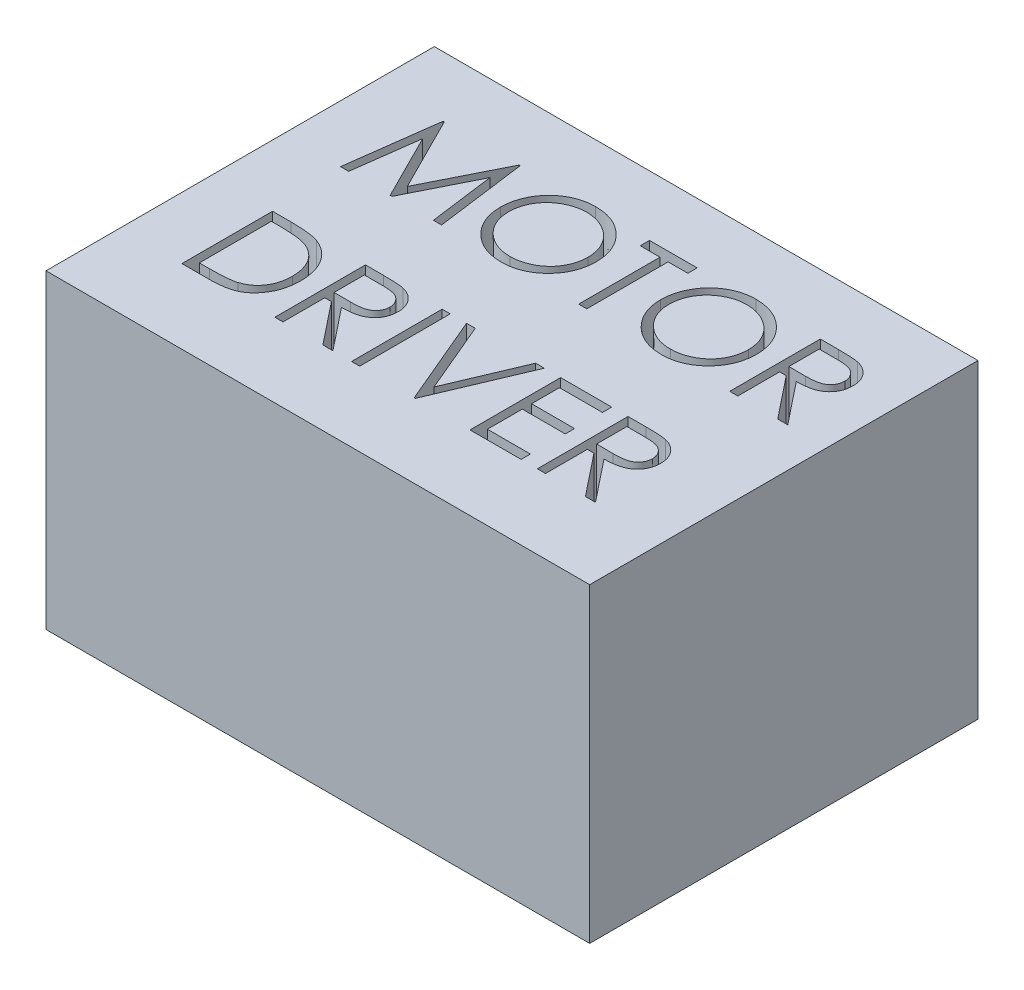
from build123d import *

# Parameters (mm, degrees)
SKETCH1_W           = 44.45
SKETCH1_H           = 31.75
BOSS_EXTRUDE1_DEPTH = 25.4
SKETCH2_W           = 0.664850428
SKETCH2_H           = 7.408333334
CUT_EXTRUDE1_DEPTH  = 12.7


with BuildPart() as part:
    # Sketch1 → Boss-Extrude1 (new body)
    with BuildSketch(Plane(origin=(0, 0, 0), x_dir=(1, 0, 0), z_dir=(0, 1, 0))):
        Rectangle(SKETCH1_W, SKETCH1_H)
    extrude(amount=BOSS_EXTRUDE1_DEPTH)

    # Sketch2 → Cut-Extrude1 (cut, symmetric)
    # profile 1 of 11: a face of its own
    with BuildSketch(Plane(origin=(0, 25.4, 0), x_dir=(1, 0, 0), z_dir=(0, 1, 0))):
        Polygon((-17.560377568, 3.540456421), (-16.582394462, 10.948789754), (-16.48741583, 10.948789754), (-13.428807055, 4.870157275), (-10.377618487, 10.948789754), (-10.281155813, 10.948789754), (-9.297236543, 3.540456421), (-9.965055052, 3.540456421), (-10.674426714, 8.871132169), (-13.348668834, 3.540456421), (-13.498556989, 3.540456421), (-16.183187397, 8.883004498), (-16.891075018, 3.540456421), align=None)
    # profile 2 of 11: a face of its own
    with BuildSketch(Plane(origin=(0, 25.4, 0), x_dir=(1, 0, 0), z_dir=(0, 1, 0))):
        with BuildLine():
            add(Edge.make_bspline(
                [(-4.310858338, 11.138747019), (-4.17368118, 11.135272554), (-3.904253925, 11.128448419), (-3.508278725, 11.076210983), (-3.13025244, 10.985839074), (-2.767095646, 10.865479095), (-2.423152179, 10.704920646), (-2.09583319, 10.510853748), (-1.785917474, 10.281245244), (-1.497582216, 10.017870047), (-1.233725005, 9.731308403), (-1.001260212, 9.425496827), (-0.806437357, 9.102284362), (-0.646447441, 8.76264227), (-0.52093205, 8.407338672), (-0.434320074, 8.034479366), (-0.378994323, 7.646480205), (-0.372526261, 7.381840008), (-0.36924509, 7.24759117)],
                knots=[0, 0, 0, 0, 1.065120563, 2.091984664, 3.0946048, 4.079830382, 5.057816894, 6.036188127, 7.030412546, 8.04752943, 9.064399622, 10.05169764, 11.02544977, 11.989514704, 12.962713494, 13.945757189, 14.957906945, 16, 16, 16, 16], degree=3))
            add(Edge.make_bspline(
                [(-0.36924509, 7.24759117), (-0.37252578, 7.114331242), (-0.378992401, 6.851660485), (-0.43438298, 6.466123528), (-0.521253097, 6.095514887), (-0.64528186, 5.740453256), (-0.804509123, 5.400564079), (-1.000629235, 5.076741693), (-1.231644798, 4.768879938), (-1.494549299, 4.480351464), (-1.781148172, 4.215773484), (-2.088552236, 3.98522853), (-2.409848097, 3.7868458), (-2.749170313, 3.62855369), (-3.102018724, 3.502036458), (-3.471551308, 3.415776725), (-3.856036514, 3.360135817), (-4.118230138, 3.353746625), (-4.251496692, 3.350499156)],
                knots=[0, 0, 0, 0, 1.043624062, 2.057103931, 3.04512605, 4.022047818, 4.998200453, 5.980619268, 6.982898556, 8.009068085, 9.034988726, 10.034168286, 11.015286542, 11.987931943, 12.962482838, 13.94673481, 14.956375938, 16, 16, 16, 16], degree=3))
            add(Edge.make_bspline(
                [(-4.251496692, 3.350499156), (-4.385744834, 3.353778691), (-4.650383658, 3.360243529), (-5.038870383, 3.415660836), (-5.411991607, 3.502319929), (-5.768680317, 3.626164902), (-6.109135418, 3.786221374), (-6.43402276, 3.981387309), (-6.742038288, 4.212965758), (-7.030628318, 4.475785008), (-7.294680788, 4.761898126), (-7.524888133, 5.068463966), (-7.720097956, 5.389468016), (-7.87961701, 5.725801109), (-8.005906782, 6.075837329), (-8.092065314, 6.441911606), (-8.147809746, 6.821936894), (-8.154233504, 7.080684362), (-8.157492953, 7.211974182)],
                knots=[0, 0, 0, 0, 1.053102029, 2.075944431, 3.073151272, 4.055350789, 5.033113405, 6.020478099, 7.024410459, 8.052272461, 9.079885166, 10.07527673, 11.055994387, 12.023226415, 12.992069828, 13.970394897, 14.97016774, 16, 16, 16, 16], degree=3))
            add(Edge.make_bspline(
                [(-8.157492953, 7.211974182), (-8.156361308, 7.300096665), (-8.154112294, 7.475229927), (-8.127036545, 7.735297564), (-8.08774761, 7.991182789), (-8.031440229, 8.242157963), (-7.957797867, 8.487608714), (-7.870904409, 8.729227828), (-7.76477507, 8.96456671), (-7.644801031, 9.194740223), (-7.510896871, 9.41616029), (-7.362993201, 9.625455408), (-7.206285005, 9.824381851), (-7.034489155, 10.007784676), (-6.853267679, 10.180999248), (-6.659680779, 10.341363666), (-6.454909695, 10.490323979), (-6.238073324, 10.624563701), (-6.014514643, 10.745973869), (-5.784058796, 10.85016012), (-5.54983572, 10.939580951), (-5.310748382, 11.012057364), (-5.067431681, 11.069275173), (-4.81935457, 11.108237405), (-4.566714685, 11.135382212), (-4.396510726, 11.137620591), (-4.310858338, 11.138747019)],
                knots=[0, 0, 0, 0, 1.037015668, 2.060948919, 3.074880161, 4.083647147, 5.086022904, 6.090072063, 7.104153813, 8.122640571, 9.144368836, 10.147691507, 11.138137339, 12.123020368, 13.103399296, 14.087645067, 15.080126199, 16.082011238, 17.087798457, 18.072939717, 19.057185487, 20.037253025, 21.01195951, 21.997135196, 22.992090687, 24, 24, 24, 24], degree=3))
        make_face()
        with BuildLine():
            add(Edge.make_bspline(
                [(-4.278209433, 10.378917959), (-4.34851374, 10.378060941), (-4.488450242, 10.376355099), (-4.696485843, 10.353885168), (-4.901785437, 10.321860236), (-5.10439142, 10.276179351), (-5.303456066, 10.213940772), (-5.500834896, 10.14231085), (-5.694728027, 10.055059542), (-5.884495359, 9.956480651), (-6.068465602, 9.847368768), (-6.242059153, 9.726778528), (-6.405725416, 9.597537922), (-6.559063664, 9.459345332), (-6.701623645, 9.311497009), (-6.836211263, 9.156234352), (-6.957431878, 8.989119516), (-7.068526349, 8.814684155), (-7.167941611, 8.633155475), (-7.256344945, 8.4464446), (-7.328658763, 8.253028496), (-7.387634126, 8.055005529), (-7.436528726, 7.852689323), (-7.467503865, 7.644545109), (-7.490220693, 7.431618789), (-7.491829032, 7.287723864), (-7.492642526, 7.214942265)],
                knots=[0, 0, 0, 0, 1.008559885, 2.007477868, 2.99961109, 3.989939068, 4.984837346, 5.991145699, 7.001802488, 8.033829008, 9.059044045, 10.069351652, 11.065060232, 12.050310815, 13.029377138, 14.011219647, 14.996725999, 15.989392538, 16.977580475, 17.965360261, 18.951710183, 19.937753436, 20.929683414, 21.935841486, 22.955955122, 24, 24, 24, 24], degree=3))
            add(Edge.make_bspline(
                [(-7.492642526, 7.214942265), (-7.489944068, 7.107918897), (-7.484635366, 6.897370825), (-7.43815851, 6.588828254), (-7.366568664, 6.292308048), (-7.261037238, 6.009432673), (-7.12906177, 5.737770608), (-6.966021519, 5.479731786), (-6.772856455, 5.235246469), (-6.553435324, 5.006021483), (-6.313568928, 4.796797864), (-6.05886465, 4.613148649), (-5.79205118, 4.45776362), (-5.512432735, 4.331176217), (-5.22150211, 4.230867938), (-4.917384627, 4.162121503), (-4.602106155, 4.116876789), (-4.387199601, 4.112531789), (-4.278209433, 4.110328216)],
                knots=[0, 0, 0, 0, 1.032063989, 2.030389145, 3.003944642, 3.970395727, 4.937377036, 5.913328081, 6.909231446, 7.93887556, 8.970685674, 9.976071282, 10.964166581, 11.944589148, 12.933237628, 13.927779006, 14.949070134, 16, 16, 16, 16], degree=3))
            add(Edge.make_bspline(
                [(-4.278209433, 4.110328216), (-4.204952654, 4.1113347), (-4.059662461, 4.11333086), (-3.843560272, 4.133436393), (-3.63135129, 4.165677183), (-3.423333164, 4.212097071), (-3.21974198, 4.270193658), (-3.01972798, 4.339213349), (-2.825421599, 4.425321897), (-2.634371609, 4.520461727), (-2.451499564, 4.628920061), (-2.276926354, 4.745417478), (-2.115052197, 4.874467725), (-1.961828662, 5.010607095), (-1.818683387, 5.156580573), (-1.686584371, 5.312198376), (-1.565976424, 5.478442767), (-1.454924139, 5.652613542), (-1.355857233, 5.834638944), (-1.269541473, 6.022026762), (-1.196313028, 6.214315577), (-1.137197693, 6.411782736), (-1.090873466, 6.6140532), (-1.058954302, 6.821397798), (-1.036626773, 7.03340174), (-1.03494386, 7.176792902), (-1.034095517, 7.249075211)],
                knots=[0, 0, 0, 0, 1.047197238, 2.076906641, 3.100256066, 4.114471768, 5.12198147, 6.126382909, 7.136867548, 8.15857795, 9.17633901, 10.174870724, 11.156907918, 12.133735059, 13.104061851, 14.077631395, 15.04955518, 16.038496417, 17.029181396, 18.010275684, 18.986308667, 19.968651475, 20.955262928, 21.950658345, 22.966943676, 24, 24, 24, 24], degree=3))
            add(Edge.make_bspline(
                [(-1.034095517, 7.249075211), (-1.034944539, 7.320863028), (-1.036628732, 7.463267388), (-1.058943637, 7.673792787), (-1.090907188, 7.879645417), (-1.136971587, 8.080017134), (-1.196344412, 8.274959012), (-1.269554261, 8.464287961), (-1.355883145, 8.648709307), (-1.454960553, 8.827767236), (-1.566330713, 8.999587098), (-1.688026861, 9.163845538), (-1.822150182, 9.31745784), (-1.964868601, 9.464216276), (-2.119746975, 9.600990809), (-2.286083731, 9.727826811), (-2.461859515, 9.847785242), (-2.647972164, 9.956001014), (-2.840046866, 10.055937807), (-3.037138077, 10.141559097), (-3.237013004, 10.214313416), (-3.439163375, 10.276367659), (-3.64529068, 10.321681323), (-3.854002117, 10.353914028), (-4.065008931, 10.376347278), (-4.20691708, 10.378058346), (-4.278209433, 10.378917959)],
                knots=[0, 0, 0, 0, 1.02996197, 2.043119294, 3.035359645, 4.018872909, 4.991431989, 5.957985074, 6.929999688, 7.912076566, 8.892894881, 9.867085534, 10.843653904, 11.817741046, 12.803660682, 13.806313499, 14.818574707, 15.856120519, 16.894564902, 17.924820532, 18.937903209, 19.946497019, 20.957711757, 21.963978472, 22.977135795, 24, 24, 24, 24], degree=3))
        make_face(mode=Mode.SUBTRACT)
    # profile 3 of 11: a face of its own
    with BuildSketch(Plane(origin=(0, 25.4, 0), x_dir=(1, 0, 0), z_dir=(0, 1, 0))):
        Polygon((0.295605338, 10.188960694), (0.295605338, 10.948789754), (4.189729269, 10.948789754), (4.189729269, 10.188960694), (2.575092517, 10.188960694), (2.575092517, 3.540456421), (1.91024209, 3.540456421), (1.91024209, 10.188960694), align=None)
    # profile 4 of 11: a face of its own
    with BuildSketch(Plane(origin=(0, 25.4, 0), x_dir=(1, 0, 0), z_dir=(0, 1, 0))):
        with BuildLine():
            add(Edge.make_bspline(
                [(8.796192945, 11.138747019), (8.933370102, 11.135272554), (9.202797357, 11.128448419), (9.598772557, 11.076210983), (9.976798842, 10.985839074), (10.339955636, 10.865479095), (10.683899103, 10.704920646), (11.011218092, 10.510853748), (11.321133809, 10.281245244), (11.609469066, 10.017870047), (11.873326278, 9.731308403), (12.10579107, 9.425496827), (12.300613925, 9.102284362), (12.460603841, 8.76264227), (12.586119232, 8.407338672), (12.672731208, 8.034479366), (12.728056959, 7.646480205), (12.734525021, 7.381840008), (12.737806192, 7.24759117)],
                knots=[0, 0, 0, 0, 1.065120563, 2.091984664, 3.0946048, 4.079830382, 5.057816894, 6.036188127, 7.030412546, 8.04752943, 9.064399622, 10.05169764, 11.02544977, 11.989514704, 12.962713494, 13.945757189, 14.957906945, 16, 16, 16, 16], degree=3))
            add(Edge.make_bspline(
                [(12.737806192, 7.24759117), (12.734525502, 7.114331242), (12.728058881, 6.851660485), (12.672668302, 6.466123528), (12.585798185, 6.095514887), (12.461769422, 5.740453256), (12.302542159, 5.400564079), (12.106422047, 5.076741693), (11.875406484, 4.768879938), (11.612501983, 4.480351464), (11.32590311, 4.215773484), (11.018499046, 3.98522853), (10.697203185, 3.7868458), (10.357880969, 3.62855369), (10.005032558, 3.502036458), (9.635499974, 3.415776725), (9.251014768, 3.360135817), (8.988821144, 3.353746625), (8.85555459, 3.350499156)],
                knots=[0, 0, 0, 0, 1.043624062, 2.057103931, 3.04512605, 4.022047818, 4.998200453, 5.980619268, 6.982898556, 8.009068085, 9.034988726, 10.034168286, 11.015286542, 11.987931943, 12.962482838, 13.94673481, 14.956375938, 16, 16, 16, 16], degree=3))
            add(Edge.make_bspline(
                [(8.85555459, 3.350499156), (8.721306448, 3.353778691), (8.456667624, 3.360243529), (8.068180899, 3.415660836), (7.695059675, 3.502319929), (7.338370965, 3.626164902), (6.997915864, 3.786221374), (6.673028522, 3.981387309), (6.365012994, 4.212965758), (6.076422964, 4.475785008), (5.812370494, 4.761898126), (5.582163149, 5.068463966), (5.386953326, 5.389468016), (5.227434272, 5.725801109), (5.1011445, 6.075837329), (5.014985968, 6.441911606), (4.959241536, 6.821936894), (4.952817778, 7.080684362), (4.949558329, 7.211974182)],
                knots=[0, 0, 0, 0, 1.053102029, 2.075944431, 3.073151272, 4.055350789, 5.033113405, 6.020478099, 7.024410459, 8.052272461, 9.079885166, 10.07527673, 11.055994387, 12.023226415, 12.992069828, 13.970394897, 14.97016774, 16, 16, 16, 16], degree=3))
            add(Edge.make_bspline(
                [(4.949558329, 7.211974182), (4.950689974, 7.300096665), (4.952938988, 7.475229927), (4.980014737, 7.735297564), (5.019303672, 7.991182789), (5.075611053, 8.242157963), (5.149253415, 8.487608714), (5.236146873, 8.729227828), (5.342276212, 8.96456671), (5.462250251, 9.194740223), (5.596154411, 9.41616029), (5.744058081, 9.625455408), (5.900766277, 9.824381851), (6.072562127, 10.007784676), (6.253783603, 10.180999248), (6.447370503, 10.341363666), (6.652141587, 10.490323979), (6.868977958, 10.624563701), (7.092536639, 10.745973869), (7.322992486, 10.85016012), (7.557215562, 10.939580951), (7.7963029, 11.012057364), (8.039619601, 11.069275173), (8.287696712, 11.108237405), (8.540336597, 11.135382212), (8.710540556, 11.137620591), (8.796192945, 11.138747019)],
                knots=[0, 0, 0, 0, 1.037015668, 2.060948919, 3.074880161, 4.083647147, 5.086022904, 6.090072063, 7.104153813, 8.122640571, 9.144368836, 10.147691507, 11.138137339, 12.123020368, 13.103399296, 14.087645067, 15.080126199, 16.082011238, 17.087798457, 18.072939717, 19.057185487, 20.037253025, 21.01195951, 21.997135196, 22.992090687, 24, 24, 24, 24], degree=3))
        make_face()
        with BuildLine():
            add(Edge.make_bspline(
                [(8.828841849, 10.378917959), (8.758537542, 10.378060941), (8.61860104, 10.376355099), (8.410565439, 10.353885168), (8.205265845, 10.321860236), (8.002659862, 10.276179351), (7.803595216, 10.213940772), (7.606216386, 10.14231085), (7.412323255, 10.055059542), (7.222555923, 9.956480651), (7.03858568, 9.847368768), (6.864992129, 9.726778528), (6.701325866, 9.597537922), (6.547987618, 9.459345332), (6.405427637, 9.311497009), (6.270840019, 9.156234352), (6.149619404, 8.989119516), (6.038524933, 8.814684155), (5.939109672, 8.633155475), (5.850706337, 8.4464446), (5.778392519, 8.253028496), (5.719417156, 8.055005529), (5.670522556, 7.852689323), (5.639547417, 7.644545109), (5.616830589, 7.431618789), (5.61522225, 7.287723864), (5.614408756, 7.214942265)],
                knots=[0, 0, 0, 0, 1.008559885, 2.007477868, 2.99961109, 3.989939068, 4.984837346, 5.991145699, 7.001802488, 8.033829008, 9.059044045, 10.069351652, 11.065060232, 12.050310815, 13.029377138, 14.011219647, 14.996725999, 15.989392538, 16.977580475, 17.965360261, 18.951710183, 19.937753436, 20.929683414, 21.935841486, 22.955955122, 24, 24, 24, 24], degree=3))
            add(Edge.make_bspline(
                [(5.614408756, 7.214942265), (5.617107214, 7.107918897), (5.622415916, 6.897370825), (5.668892772, 6.588828254), (5.740482618, 6.292308048), (5.846014044, 6.009432673), (5.977989512, 5.737770608), (6.141029763, 5.479731786), (6.334194827, 5.235246469), (6.553615958, 5.006021483), (6.793482354, 4.796797864), (7.048186632, 4.613148649), (7.315000102, 4.45776362), (7.594618547, 4.331176217), (7.885549172, 4.230867938), (8.189666655, 4.162121503), (8.504945127, 4.116876789), (8.719851681, 4.112531789), (8.828841849, 4.110328216)],
                knots=[0, 0, 0, 0, 1.032063989, 2.030389145, 3.003944642, 3.970395727, 4.937377036, 5.913328081, 6.909231446, 7.93887556, 8.970685674, 9.976071282, 10.964166581, 11.944589148, 12.933237628, 13.927779006, 14.949070134, 16, 16, 16, 16], degree=3))
            add(Edge.make_bspline(
                [(8.828841849, 4.110328216), (8.902098628, 4.1113347), (9.047388822, 4.11333086), (9.26349101, 4.133436393), (9.475699992, 4.165677183), (9.683718118, 4.212097071), (9.887309302, 4.270193658), (10.087323302, 4.339213349), (10.281629683, 4.425321897), (10.472679673, 4.520461727), (10.655551718, 4.628920061), (10.830124928, 4.745417478), (10.991999085, 4.874467725), (11.14522262, 5.010607095), (11.288367895, 5.156580573), (11.420466911, 5.312198376), (11.541074858, 5.478442767), (11.652127143, 5.652613542), (11.751194049, 5.834638944), (11.837509809, 6.022026762), (11.910738254, 6.214315577), (11.969853589, 6.411782736), (12.016177817, 6.6140532), (12.04809698, 6.821397798), (12.070424509, 7.03340174), (12.072107422, 7.176792902), (12.072955765, 7.249075211)],
                knots=[0, 0, 0, 0, 1.047197238, 2.076906641, 3.100256066, 4.114471768, 5.12198147, 6.126382909, 7.136867548, 8.15857795, 9.17633901, 10.174870724, 11.156907918, 12.133735059, 13.104061851, 14.077631395, 15.04955518, 16.038496417, 17.029181396, 18.010275684, 18.986308667, 19.968651475, 20.955262928, 21.950658345, 22.966943676, 24, 24, 24, 24], degree=3))
            add(Edge.make_bspline(
                [(12.072955765, 7.249075211), (12.072106743, 7.320863028), (12.07042255, 7.463267388), (12.048107645, 7.673792787), (12.016144094, 7.879645417), (11.970079696, 8.080017134), (11.91070687, 8.274959012), (11.837497021, 8.464287961), (11.751168137, 8.648709307), (11.652090729, 8.827767236), (11.540720569, 8.999587098), (11.419024421, 9.163845538), (11.2849011, 9.31745784), (11.142182681, 9.464216276), (10.987304307, 9.600990809), (10.820967551, 9.727826811), (10.645191767, 9.847785242), (10.459079118, 9.956001014), (10.267004416, 10.055937807), (10.069913205, 10.141559097), (9.870038278, 10.214313416), (9.667887907, 10.276367659), (9.461760602, 10.321681323), (9.253049165, 10.353914028), (9.042042351, 10.376347278), (8.900134202, 10.378058346), (8.828841849, 10.378917959)],
                knots=[0, 0, 0, 0, 1.02996197, 2.043119294, 3.035359645, 4.018872909, 4.991431989, 5.957985074, 6.929999688, 7.912076566, 8.892894881, 9.867085534, 10.843653904, 11.817741046, 12.803660682, 13.806313499, 14.818574707, 15.856120519, 16.894564902, 17.924820532, 18.937903209, 19.946497019, 20.957711757, 21.963978472, 22.977135795, 24, 24, 24, 24], degree=3))
        make_face(mode=Mode.SUBTRACT)
    # profile 5 of 11: a face of its own
    with BuildSketch(Plane(origin=(0, 25.4, 0), x_dir=(1, 0, 0), z_dir=(0, 1, 0))):
        with BuildLine():
            Line((14.257464312, 10.948789754), (15.740021403, 10.948789754))
            add(Edge.make_bspline(
                [(15.740021403, 10.948789754), (15.838956792, 10.94846043), (16.028923698, 10.947828092), (16.301070453, 10.944302228), (16.548354475, 10.934196508), (16.770646469, 10.925500006), (16.967942355, 10.909642064), (17.14084712, 10.894485361), (17.288564413, 10.874644445), (17.377984799, 10.856217967), (17.418471924, 10.847874957)],
                knots=[0, 0, 0, 0, 1.410062039, 2.707475311, 3.878576406, 4.937260626, 5.877586885, 6.699081471, 7.410979367, 8, 8, 8, 8], degree=3))
            add(Edge.make_bspline(
                [(17.418471924, 10.847874957), (17.472672612, 10.834483304), (17.57991774, 10.807985677), (17.734328713, 10.751979522), (17.881467365, 10.687167983), (18.020722493, 10.611044775), (18.151396585, 10.523044825), (18.274837009, 10.424687299), (18.391603907, 10.31651038), (18.496975024, 10.195786633), (18.59632935, 10.069132687), (18.680125276, 9.932176402), (18.752359658, 9.788959502), (18.809870586, 9.638025468), (18.856178963, 9.48083805), (18.88883117, 9.315973431), (18.90841285, 9.1441827), (18.910406444, 9.02700846), (18.911417303, 8.967594842)],
                knots=[0, 0, 0, 0, 1.027469482, 2.033020251, 3.019912614, 3.986113645, 4.951240523, 5.91722682, 6.890402269, 7.87763091, 8.8651537, 9.85103654, 10.82876324, 11.815024772, 12.821070561, 13.842952187, 14.906261191, 16, 16, 16, 16], degree=3))
            add(Edge.make_bspline(
                [(18.911417303, 8.967594842), (18.908307924, 8.868883871), (18.90224072, 8.676273199), (18.845672584, 8.396744333), (18.753012284, 8.135993617), (18.625327988, 7.894349367), (18.462726765, 7.676521834), (18.267305957, 7.48519537), (18.038956546, 7.325090889), (17.826381161, 7.214065785), (17.638602771, 7.142960796), (17.484015593, 7.092930503), (17.315387157, 7.054276009), (17.134333132, 7.019647064), (16.940100061, 6.993502644), (16.733153478, 6.974354019), (16.51334579, 6.962386283), (16.36234476, 6.960604039), (16.284664499, 6.95968719)],
                knots=[0, 0, 0, 0, 1.260483769, 2.459530307, 3.627416485, 4.787058657, 5.939039949, 7.08810263, 8.267026773, 9.491475466, 10.141966685, 10.831826277, 11.566392101, 12.351337768, 13.187381173, 14.07005841, 15.007169909, 16, 16, 16, 16], degree=3))
            Line((16.284664499, 6.95968719), (19.006395936, 3.540456421))
            Line((19.006395936, 3.540456421), (18.184237149, 3.540456421))
            Line((18.184237149, 3.540456421), (15.462505712, 6.95968719))
            Line((15.462505712, 6.95968719), (14.922314739, 6.95968719))
            Line((14.922314739, 6.95968719), (14.922314739, 3.540456421))
            Line((14.922314739, 3.540456421), (14.257464312, 3.540456421))
            Line((14.257464312, 3.540456421), (14.257464312, 10.948789754))
        make_face()
        with BuildLine():
            Line((14.922314739, 10.188960694), (14.922314739, 7.71951625))
            Line((14.922314739, 7.71951625), (16.278728334, 7.709127962))
            add(Edge.make_bspline(
                [(16.278728334, 7.709127962), (16.342059084, 7.709099944), (16.464812113, 7.709045638), (16.642401853, 7.717499131), (16.80775609, 7.727115822), (16.960242348, 7.74182527), (17.09992875, 7.760782288), (17.226745474, 7.784495271), (17.340899534, 7.812122137), (17.474034774, 7.854882245), (17.622702098, 7.922628317), (17.784270355, 8.021191956), (17.921858637, 8.145163258), (18.038101445, 8.28692374), (18.131508742, 8.442787134), (18.19736259, 8.610885115), (18.23915076, 8.786973998), (18.244079514, 8.908000993), (18.246566876, 8.969078883)],
                knots=[0, 0, 0, 0, 1.146690395, 2.22261258, 3.21895312, 4.145990853, 4.996080663, 5.770904154, 6.481378293, 7.121626537, 8.300444488, 9.431385265, 10.535395872, 11.636531494, 12.74115979, 13.810798291, 14.895190096, 16, 16, 16, 16], degree=3))
            add(Edge.make_bspline(
                [(18.246566876, 8.969078883), (18.244022387, 9.028655798), (18.238980137, 9.146715503), (18.197813576, 9.319553846), (18.128197719, 9.482678891), (18.034382316, 9.635427051), (17.920084104, 9.774080858), (17.786061401, 9.892713999), (17.635978738, 9.990608699), (17.495704701, 10.053165471), (17.370325618, 10.091519161), (17.261466171, 10.118509124), (17.138463543, 10.14019325), (17.000720489, 10.157566979), (16.848825037, 10.172499944), (16.682009159, 10.182557876), (16.501379641, 10.188513888), (16.376185303, 10.188808293), (16.311377239, 10.188960694)],
                knots=[0, 0, 0, 0, 1.101028733, 2.181837193, 3.264309656, 4.369019818, 5.486613113, 6.575447106, 7.666700264, 8.788928104, 9.402425223, 10.0903467, 10.862060571, 11.710948788, 12.657782767, 13.684531032, 14.801375019, 16, 16, 16, 16], degree=3))
            Line((16.311377239, 10.188960694), (14.922314739, 10.188960694))
        make_face(mode=Mode.SUBTRACT)
    # profile 6 of 11: a face of its own
    with BuildSketch(Plane(origin=(0, 25.4, 0), x_dir=(1, 0, 0), z_dir=(0, 1, 0))):
        with BuildLine():
            Line((-17.180463038, -9.806765802), (-17.180463038, -2.398432468))
            Line((-17.180463038, -2.398432468), (-15.684549577, -2.398432468))
            add(Edge.make_bspline(
                [(-15.684549577, -2.398432468), (-15.554440218, -2.399369241), (-15.303069615, -2.401179082), (-14.939823268, -2.41265436), (-14.603730971, -2.43295418), (-14.295898086, -2.46252301), (-14.01547952, -2.498830264), (-13.763260467, -2.544339454), (-13.537936764, -2.598077747), (-13.399359782, -2.643893951), (-13.333828423, -2.665559872)],
                knots=[0, 0, 0, 0, 1.314313732, 2.53924729, 3.670748893, 4.714932338, 5.66265055, 6.526160246, 7.303039223, 8, 8, 8, 8], degree=3))
            add(Edge.make_bspline(
                [(-13.333828423, -2.665559872), (-13.248114558, -2.698221532), (-13.078630534, -2.762804195), (-12.837315458, -2.884631699), (-12.61014344, -3.022666098), (-12.39589625, -3.177089341), (-12.199467834, -3.352273878), (-12.013184453, -3.540778043), (-11.844666621, -3.749456696), (-11.690344061, -3.973982088), (-11.551203582, -4.211709265), (-11.430259031, -4.462185245), (-11.329814745, -4.724138002), (-11.246432415, -4.996839065), (-11.180717414, -5.280888065), (-11.135882325, -5.576615748), (-11.106310396, -5.882853366), (-11.103338488, -6.09065598), (-11.10183056, -6.196093726)],
                knots=[0, 0, 0, 0, 0.984719456, 1.947108742, 2.898477687, 3.838006223, 4.779231079, 5.722358779, 6.681677486, 7.655904652, 8.64651281, 9.637519902, 10.640069247, 11.656948941, 12.698408672, 13.768548281, 14.867775369, 16, 16, 16, 16], degree=3))
            add(Edge.make_bspline(
                [(-11.10183056, -6.196093726), (-11.103161874, -6.287663348), (-11.105785369, -6.468110851), (-11.12934242, -6.734050747), (-11.163582298, -6.992101139), (-11.216592517, -7.241033204), (-11.280944503, -7.483027932), (-11.363418624, -7.715506183), (-11.457897091, -7.940600579), (-11.568069333, -8.15526757), (-11.689018598, -8.358644041), (-11.818816288, -8.550362243), (-11.95732396, -8.727686462), (-12.105862383, -8.891153691), (-12.26251205, -9.040517498), (-12.428298549, -9.177025598), (-12.603649673, -9.298006972), (-12.787780037, -9.408215684), (-12.986061177, -9.504355437), (-13.20224876, -9.585698958), (-13.437264754, -9.653107627), (-13.690532296, -9.709349356), (-13.96248899, -9.75396298), (-14.253401468, -9.783863844), (-14.562822764, -9.804084218), (-14.775292209, -9.805854584), (-14.884651406, -9.806765802)],
                knots=[0, 0, 0, 0, 1.105936401, 2.179363191, 3.223086493, 4.248585256, 5.251745608, 6.245858792, 7.225916811, 8.198733463, 9.158002045, 10.082870192, 10.993790845, 11.873723703, 12.748670949, 13.606408763, 14.465103618, 15.319838547, 16.196477973, 17.123216899, 18.106603292, 19.147568657, 20.255746949, 21.433717677, 22.679120308, 24, 24, 24, 24], degree=3))
            Line((-14.884651406, -9.806765802), (-17.180463038, -9.806765802))
        make_face()
        with BuildLine():
            Line((-16.515612611, -9.046936742), (-15.665257042, -9.046936742))
            add(Edge.make_bspline(
                [(-15.665257042, -9.046936742), (-15.543065324, -9.046411604), (-15.308045901, -9.045401573), (-14.97010314, -9.03653866), (-14.661325084, -9.022056559), (-14.381667889, -9.001789311), (-14.131289454, -8.974974075), (-13.909666517, -8.945076364), (-13.717525554, -8.907828427), (-13.601258245, -8.874065563), (-13.547530346, -8.858463518)],
                knots=[0, 0, 0, 0, 1.375205317, 2.645023457, 3.804390687, 4.853969522, 5.800190428, 6.637939096, 7.370582563, 8, 8, 8, 8], degree=3))
            add(Edge.make_bspline(
                [(-13.547530346, -8.858463518), (-13.479906313, -8.83464772), (-13.346273446, -8.787584963), (-13.153908482, -8.701737913), (-12.974506155, -8.600048866), (-12.804939935, -8.487014052), (-12.647615181, -8.358646682), (-12.500667468, -8.217738089), (-12.364392655, -8.063571148), (-12.240198703, -7.896337206), (-12.129056127, -7.717077139), (-12.032808691, -7.527553274), (-11.948456282, -7.329842192), (-11.882249928, -7.120907807), (-11.830358608, -6.902617966), (-11.793603352, -6.674957315), (-11.770712185, -6.437968368), (-11.768042121, -6.276779705), (-11.766680987, -6.194609685)],
                knots=[0, 0, 0, 0, 0.998632004, 1.973411704, 2.929992603, 3.868527914, 4.809262121, 5.754881198, 6.702106254, 7.672490631, 8.653608572, 9.636854334, 10.631411391, 11.644891563, 12.686317036, 13.754757253, 14.855430412, 16, 16, 16, 16], degree=3))
            add(Edge.make_bspline(
                [(-11.766680987, -6.194609685), (-11.767767445, -6.107967152), (-11.769901802, -5.937757128), (-11.796729093, -5.688010157), (-11.835933052, -5.447809446), (-11.892625187, -5.217138933), (-11.964868881, -4.995548587), (-12.055027539, -4.784263957), (-12.15803855, -4.581053652), (-12.280600613, -4.390607911), (-12.414830286, -4.210494163), (-12.563796797, -4.045489592), (-12.725133445, -3.895218323), (-12.897080543, -3.757340111), (-13.08448407, -3.637401997), (-13.282929382, -3.530115189), (-13.495327719, -3.439064885), (-13.643097925, -3.390637959), (-13.718195076, -3.366027287)],
                knots=[0, 0, 0, 0, 1.122418816, 2.205001699, 3.251619955, 4.274784885, 5.280384055, 6.268708349, 7.249350384, 8.229342522, 9.199999885, 10.157847722, 11.105861043, 12.055065948, 13.010012805, 13.98527497, 14.976112212, 16, 16, 16, 16], degree=3))
            add(Edge.make_bspline(
                [(-13.718195076, -3.366027287), (-13.780321669, -3.348847514), (-13.912419852, -3.312318605), (-14.127980051, -3.272471566), (-14.370582117, -3.237325377), (-14.641303151, -3.207569193), (-14.939834556, -3.186217696), (-15.266405929, -3.170191747), (-15.621158426, -3.159382708), (-15.867078122, -3.158644612), (-15.994714174, -3.158261528)],
                knots=[0, 0, 0, 0, 0.674548936, 1.434276114, 2.292660221, 3.240891867, 4.284742987, 5.42552168, 6.663806718, 8, 8, 8, 8], degree=3))
            Line((-15.994714174, -3.158261528), (-16.515612611, -3.158261528))
            Line((-16.515612611, -3.158261528), (-16.515612611, -9.046936742))
        make_face(mode=Mode.SUBTRACT)
    # profile 7 of 11: a face of its own
    with BuildSketch(Plane(origin=(0, 25.4, 0), x_dir=(1, 0, 0), z_dir=(0, 1, 0))):
        with BuildLine():
            Line((-9.58217244, -2.398432468), (-8.099615349, -2.398432468))
            add(Edge.make_bspline(
                [(-8.099615349, -2.398432468), (-8.00067996, -2.398761792), (-7.810713054, -2.39939413), (-7.538566299, -2.402919995), (-7.291282277, -2.413025714), (-7.068990284, -2.421722216), (-6.871694397, -2.437580158), (-6.698789632, -2.452736861), (-6.551072339, -2.472577777), (-6.461651954, -2.491004255), (-6.421164828, -2.499347265)],
                knots=[0, 0, 0, 0, 1.410062039, 2.707475311, 3.878576406, 4.937260626, 5.877586885, 6.699081471, 7.410979367, 8, 8, 8, 8], degree=3))
            add(Edge.make_bspline(
                [(-6.421164828, -2.499347265), (-6.36696414, -2.512738919), (-6.259719012, -2.539236545), (-6.105308039, -2.5952427), (-5.958169387, -2.660054239), (-5.818914259, -2.736177447), (-5.688240167, -2.824177397), (-5.564799743, -2.922534923), (-5.448032845, -3.030711842), (-5.342661728, -3.15143559), (-5.243307402, -3.278089535), (-5.159511476, -3.41504582), (-5.087277094, -3.55826272), (-5.029766166, -3.709196755), (-4.983457789, -3.866384172), (-4.950805582, -4.031248792), (-4.931223902, -4.203039522), (-4.929230308, -4.320213762), (-4.928219449, -4.37962738)],
                knots=[0, 0, 0, 0, 1.027469482, 2.033020251, 3.019912614, 3.986113645, 4.951240523, 5.91722682, 6.890402269, 7.87763091, 8.8651537, 9.85103654, 10.82876324, 11.815024772, 12.821070561, 13.842952187, 14.906261191, 16, 16, 16, 16], degree=3))
            add(Edge.make_bspline(
                [(-4.928219449, -4.37962738), (-4.931328828, -4.478338351), (-4.937396032, -4.670949023), (-4.993964169, -4.950477889), (-5.086624469, -5.211228605), (-5.214308764, -5.452872855), (-5.376909987, -5.670700388), (-5.572330795, -5.862026852), (-5.800680206, -6.022131333), (-6.013255591, -6.133156437), (-6.201033981, -6.204261427), (-6.35562116, -6.25429172), (-6.524249595, -6.292946213), (-6.70530362, -6.327575158), (-6.899536691, -6.353719578), (-7.106483274, -6.372868203), (-7.326290962, -6.38483594), (-7.477291992, -6.386618183), (-7.554972253, -6.387535032)],
                knots=[0, 0, 0, 0, 1.260483769, 2.459530307, 3.627416485, 4.787058657, 5.939039949, 7.08810263, 8.267026773, 9.491475466, 10.141966685, 10.831826277, 11.566392101, 12.351337768, 13.187381173, 14.07005841, 15.007169909, 16, 16, 16, 16], degree=3))
            Line((-7.554972253, -6.387535032), (-4.833240816, -9.806765802))
            Line((-4.833240816, -9.806765802), (-5.655399604, -9.806765802))
            Line((-5.655399604, -9.806765802), (-8.377131041, -6.387535032))
            Line((-8.377131041, -6.387535032), (-8.917322013, -6.387535032))
            Line((-8.917322013, -6.387535032), (-8.917322013, -9.806765802))
            Line((-8.917322013, -9.806765802), (-9.58217244, -9.806765802))
            Line((-9.58217244, -9.806765802), (-9.58217244, -2.398432468))
        make_face()
        with BuildLine():
            Line((-8.917322013, -3.158261528), (-8.917322013, -5.627705972))
            Line((-8.917322013, -5.627705972), (-7.560908418, -5.63809426))
            add(Edge.make_bspline(
                [(-7.560908418, -5.63809426), (-7.497577669, -5.638122278), (-7.374824639, -5.638176584), (-7.197234899, -5.629723091), (-7.031880662, -5.620106401), (-6.879394404, -5.605396953), (-6.739708003, -5.586439934), (-6.612891278, -5.562726951), (-6.498737218, -5.535100085), (-6.365601978, -5.492339977), (-6.216934654, -5.424593905), (-6.055366397, -5.326030266), (-5.917778115, -5.202058964), (-5.801535307, -5.060298482), (-5.70812801, -4.904435089), (-5.642274162, -4.736337107), (-5.600485992, -4.560248225), (-5.595557238, -4.43922123), (-5.593069876, -4.378143339)],
                knots=[0, 0, 0, 0, 1.146690395, 2.22261258, 3.21895312, 4.145990853, 4.996080663, 5.770904154, 6.481378293, 7.121626537, 8.300444488, 9.431385265, 10.535395872, 11.636531494, 12.74115979, 13.810798291, 14.895190096, 16, 16, 16, 16], degree=3))
            add(Edge.make_bspline(
                [(-5.593069876, -4.378143339), (-5.595614366, -4.318566425), (-5.600656616, -4.200506719), (-5.641823176, -4.027668376), (-5.711439033, -3.864543331), (-5.805254436, -3.711795172), (-5.919552648, -3.573141364), (-6.053575351, -3.454508223), (-6.203658014, -3.356613523), (-6.343932051, -3.294056751), (-6.469311134, -3.255703062), (-6.578170581, -3.228713098), (-6.701173209, -3.207028972), (-6.838916263, -3.189655243), (-6.990811715, -3.174722278), (-7.157627593, -3.164664347), (-7.338257111, -3.158708334), (-7.463451449, -3.15841393), (-7.528259513, -3.158261528)],
                knots=[0, 0, 0, 0, 1.101028733, 2.181837193, 3.264309656, 4.369019818, 5.486613113, 6.575447106, 7.666700264, 8.788928104, 9.402425223, 10.0903467, 10.862060571, 11.710948788, 12.657782767, 13.684531032, 14.801375019, 16, 16, 16, 16], degree=3))
            Line((-7.528259513, -3.158261528), (-8.917322013, -3.158261528))
        make_face(mode=Mode.SUBTRACT)
    # profile 8 of 11: a face of its own
    with BuildSketch(Plane(origin=(0, 25.4, 0), x_dir=(1, 0, 0), z_dir=(0, 1, 0))):
        with Locations((-2.981157483, -6.102599135)):
            Rectangle(SKETCH2_W, SKETCH2_H)
    # profile 9 of 11: a face of its own
    with BuildSketch(Plane(origin=(0, 25.4, 0), x_dir=(1, 0, 0), z_dir=(0, 1, 0))):
        Polygon((-1.319031414, -2.398432468), (-0.606691671, -2.398432468), (1.862752774, -8.236650283), (4.332197218, -2.398432468), (5.044536962, -2.398432468), (1.91024209, -9.806765802), (1.815263457, -9.806765802), align=None)
    # profile 10 of 11: a face of its own
    with BuildSketch(Plane(origin=(0, 25.4, 0), x_dir=(1, 0, 0), z_dir=(0, 1, 0))):
        Polygon((6.374237816, -2.398432468), (10.553297645, -2.398432468), (10.553297645, -3.158261528), (7.039088244, -3.158261528), (7.039088244, -5.437748708), (10.553297645, -5.437748708), (10.553297645, -6.197577767), (7.039088244, -6.197577767), (7.039088244, -9.046936742), (10.553297645, -9.046936742), (10.553297645, -9.806765802), (6.374237816, -9.806765802), align=None)
    # profile 11 of 11: a face of its own
    with BuildSketch(Plane(origin=(0, 25.4, 0), x_dir=(1, 0, 0), z_dir=(0, 1, 0))):
        with BuildLine():
            Line((11.8829985, -2.398432468), (13.365555591, -2.398432468))
            add(Edge.make_bspline(
                [(13.365555591, -2.398432468), (13.46449098, -2.398761792), (13.654457886, -2.39939413), (13.926604641, -2.402919995), (14.173888663, -2.413025714), (14.396180657, -2.421722216), (14.593476543, -2.437580158), (14.766381308, -2.452736861), (14.914098601, -2.472577777), (15.003518987, -2.491004255), (15.044006112, -2.499347265)],
                knots=[0, 0, 0, 0, 1.410062039, 2.707475311, 3.878576406, 4.937260626, 5.877586885, 6.699081471, 7.410979367, 8, 8, 8, 8], degree=3))
            add(Edge.make_bspline(
                [(15.044006112, -2.499347265), (15.0982068, -2.512738919), (15.205451928, -2.539236545), (15.359862901, -2.5952427), (15.507001553, -2.660054239), (15.646256681, -2.736177447), (15.776930773, -2.824177397), (15.900371197, -2.922534923), (16.017138095, -3.030711842), (16.122509212, -3.15143559), (16.221863538, -3.278089535), (16.305659464, -3.41504582), (16.377893846, -3.55826272), (16.435404774, -3.709196755), (16.481713151, -3.866384172), (16.514365358, -4.031248792), (16.533947038, -4.203039522), (16.535940632, -4.320213762), (16.536951492, -4.37962738)],
                knots=[0, 0, 0, 0, 1.027469482, 2.033020251, 3.019912614, 3.986113645, 4.951240523, 5.91722682, 6.890402269, 7.87763091, 8.8651537, 9.85103654, 10.82876324, 11.815024772, 12.821070561, 13.842952187, 14.906261191, 16, 16, 16, 16], degree=3))
            add(Edge.make_bspline(
                [(16.536951492, -4.37962738), (16.533842112, -4.478338351), (16.527774908, -4.670949023), (16.471206772, -4.950477889), (16.378546472, -5.211228605), (16.250862176, -5.452872855), (16.088260953, -5.670700388), (15.892840145, -5.862026852), (15.664490734, -6.022131333), (15.451915349, -6.133156437), (15.264136959, -6.204261427), (15.109549781, -6.25429172), (14.940921345, -6.292946213), (14.75986732, -6.327575158), (14.565634249, -6.353719578), (14.358687666, -6.372868203), (14.138879978, -6.38483594), (13.987878948, -6.386618183), (13.910198687, -6.387535032)],
                knots=[0, 0, 0, 0, 1.260483769, 2.459530307, 3.627416485, 4.787058657, 5.939039949, 7.08810263, 8.267026773, 9.491475466, 10.141966685, 10.831826277, 11.566392101, 12.351337768, 13.187381173, 14.07005841, 15.007169909, 16, 16, 16, 16], degree=3))
            Line((13.910198687, -6.387535032), (16.631930124, -9.806765802))
            Line((16.631930124, -9.806765802), (15.809771337, -9.806765802))
            Line((15.809771337, -9.806765802), (13.0880399, -6.387535032))
            Line((13.0880399, -6.387535032), (12.547848927, -6.387535032))
            Line((12.547848927, -6.387535032), (12.547848927, -9.806765802))
            Line((12.547848927, -9.806765802), (11.8829985, -9.806765802))
            Line((11.8829985, -9.806765802), (11.8829985, -2.398432468))
        make_face()
        with BuildLine():
            Line((12.547848927, -3.158261528), (12.547848927, -5.627705972))
            Line((12.547848927, -5.627705972), (13.904262523, -5.63809426))
            add(Edge.make_bspline(
                [(13.904262523, -5.63809426), (13.967593272, -5.638122278), (14.090346301, -5.638176584), (14.267936041, -5.629723091), (14.433290278, -5.620106401), (14.585776536, -5.605396953), (14.725462938, -5.586439934), (14.852279662, -5.562726951), (14.966433722, -5.535100085), (15.099568962, -5.492339977), (15.248236286, -5.424593905), (15.409804543, -5.326030266), (15.547392825, -5.202058964), (15.663635633, -5.060298482), (15.75704293, -4.904435089), (15.822896778, -4.736337107), (15.864684948, -4.560248225), (15.869613702, -4.43922123), (15.872101064, -4.378143339)],
                knots=[0, 0, 0, 0, 1.146690395, 2.22261258, 3.21895312, 4.145990853, 4.996080663, 5.770904154, 6.481378293, 7.121626537, 8.300444488, 9.431385265, 10.535395872, 11.636531494, 12.74115979, 13.810798291, 14.895190096, 16, 16, 16, 16], degree=3))
            add(Edge.make_bspline(
                [(15.872101064, -4.378143339), (15.869556575, -4.318566425), (15.864514325, -4.200506719), (15.823347764, -4.027668376), (15.753731907, -3.864543331), (15.659916504, -3.711795172), (15.545618292, -3.573141364), (15.411595589, -3.454508223), (15.261512926, -3.356613523), (15.121238889, -3.294056751), (14.995859806, -3.255703062), (14.887000359, -3.228713098), (14.763997731, -3.207028972), (14.626254677, -3.189655243), (14.474359225, -3.174722278), (14.307543347, -3.164664347), (14.126913829, -3.158708334), (14.001719491, -3.15841393), (13.936911427, -3.158261528)],
                knots=[0, 0, 0, 0, 1.101028733, 2.181837193, 3.264309656, 4.369019818, 5.486613113, 6.575447106, 7.666700264, 8.788928104, 9.402425223, 10.0903467, 10.862060571, 11.710948788, 12.657782767, 13.684531032, 14.801375019, 16, 16, 16, 16], degree=3))
            Line((13.936911427, -3.158261528), (12.547848927, -3.158261528))
        make_face(mode=Mode.SUBTRACT)
    extrude(amount=CUT_EXTRUDE1_DEPTH, both=True, mode=Mode.SUBTRACT)


solid = part.part
